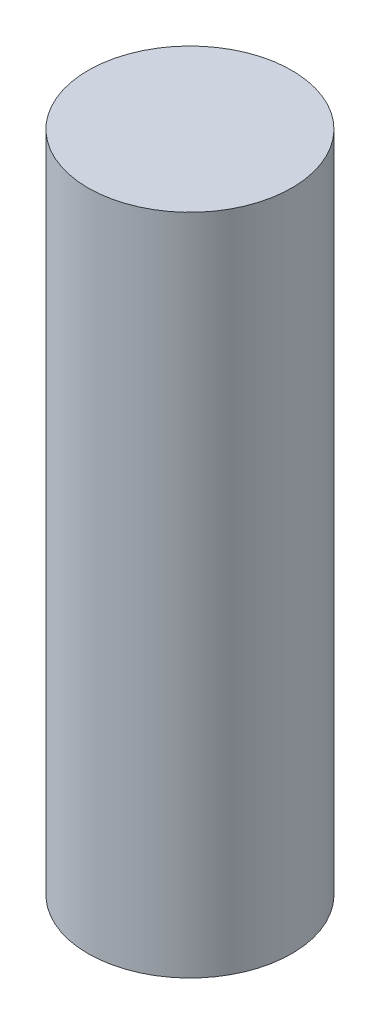
from build123d import *

# Parameters (mm, degrees)
SKETCH1_R           = 10.7749975
BOSS_EXTRUDE1_DEPTH = 70.149974


with BuildPart() as part:
    # Sketch1 → Boss-Extrude1 (new body)
    with BuildSketch(Plane(origin=(0, 0, 0), x_dir=(1, 0, 0), z_dir=(0, 1, 0))):
        with Locations(Location((0, 0, 0), (0, 0, 270))):
            Circle(SKETCH1_R)
    extrude(amount=BOSS_EXTRUDE1_DEPTH)


solid = part.part
